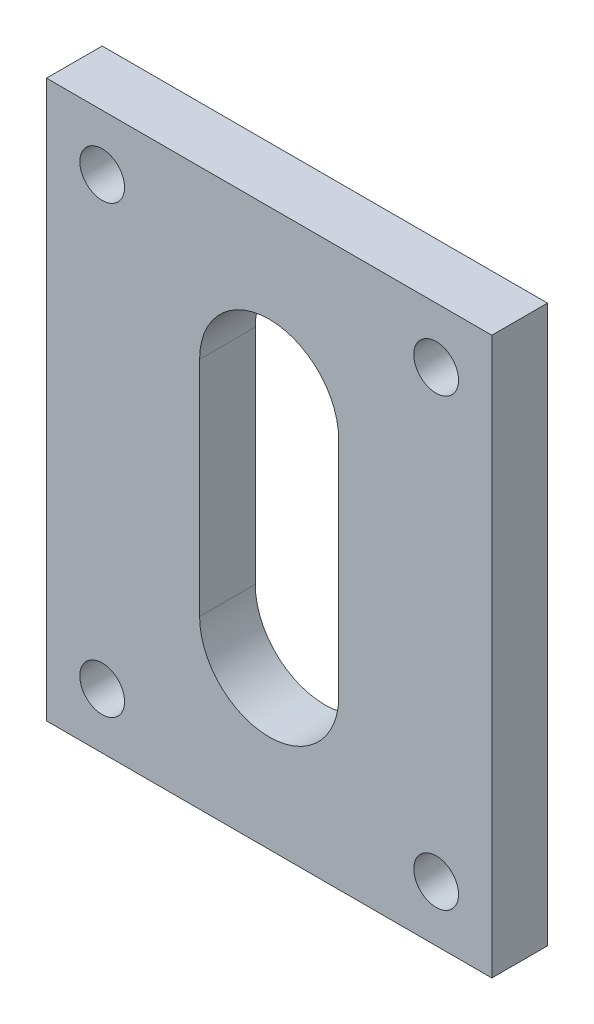
from build123d import *

# Parameters (mm, degrees)
SKETCH1_W           = 50.8
SKETCH1_H           = 63.5
SKETCH1_R           = 2.5527
BOSS_EXTRUDE1_DEPTH = 6.35


with BuildPart() as part:
    # Sketch1 → Boss-Extrude1 (new body)
    with BuildSketch(Plane.XY):
        Rectangle(SKETCH1_W, SKETCH1_H)
        with Locations(Location((-19.05, 25.4, 0), (0, 0, 180))):
            Circle(SKETCH1_R, mode=Mode.SUBTRACT)
        with Locations((19.05, 25.4)):
            Circle(SKETCH1_R, mode=Mode.SUBTRACT)
        with Locations((19.05, -25.4)):
            Circle(SKETCH1_R, mode=Mode.SUBTRACT)
        with Locations(Location((-19.05, -25.4, 0), (0, 0, 180))):
            Circle(SKETCH1_R, mode=Mode.SUBTRACT)
        with BuildLine():
            Line((-7.9375, -12.7), (-7.9375, 12.7))
            ThreePointArc((-7.9375, 12.7), (0, 20.6375), (7.9375, 12.7))
            Line((7.9375, 12.7), (7.9375, -12.7))
            ThreePointArc((7.9375, -12.7), (0, -20.6375), (-7.9375, -12.7))
        make_face(mode=Mode.SUBTRACT)
    extrude(amount=BOSS_EXTRUDE1_DEPTH)


solid = part.part
